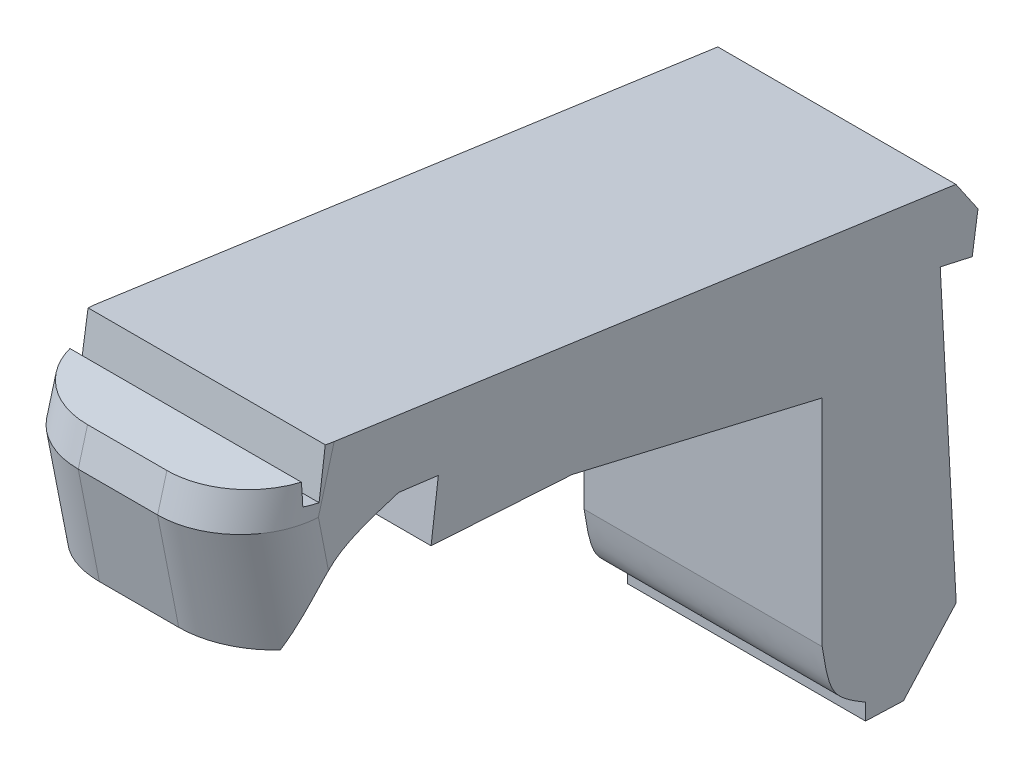
from build123d import *

# Parameters (mm, degrees)
BOSS_EXTRUDE1_DEPTH = 457.2
FILLET1_R           = 152.4


with BuildPart() as part:
    # Sketch1 → Boss-Extrude1 (new body)
    with BuildSketch(Plane(origin=(0, 0, 0), x_dir=(0, 0, -1), z_dir=(1, 0, 0))):
        with BuildLine():
            Line((711.548200753, -160.15002575), (669.063267675, -98.166541557))
            Line((669.063267675, -98.166541557), (-541.133997798, 73.322803393))
            Line((-541.133997798, 73.322803393), (-553.825031188, -16.23759413))
            Line((-553.825031188, -16.23759413), (-581.492567074, -11.395775351))
            Line((-581.492567074, -11.395775351), (-581.492567074, 28.611066701))
            Line((-581.492567074, 28.611066701), (-693.769833475, 31.192153284))
            Line((-693.769833475, 31.192153284), (-711.548200753, -33.910775567))
            Line((-711.548200753, -33.910775567), (-671.038221505, -241.199727441))
            Line((-671.038221505, -241.199727441), (-601.675855782, -250.529122735))
            add(Edge.make_bspline(
                [(-601.675855782, -250.529122735), (-541.133997798, -117.43304901), (-401.043539171, -75.545762029)],
                knots=[0, 0, 0, 1, 1, 1], degree=2, weights=[1, 2.246019703, 1]))
            Line((-401.043539171, -75.545762029), (-324.808759835, -85.222901727))
            Line((-324.808759835, -85.222901727), (-338.797926094, -195.427056695))
            Line((-338.797926094, -195.427056695), (-67.759534981, -212.336640741))
            Line((-67.759534981, -212.336640741), (412.240396354, -324.981912238))
            Line((412.240396354, -324.981912238), (412.240396354, -738.576379205))
            add(Edge.make_bspline(
                [(412.240396354, -738.576379205), (426.282298959, -832.127735112), (495.591928337, -872.720699723)],
                knots=[0, 0, 0, 1, 1, 1], degree=2, weights=[1, 2.18722751, 1]))
            Line((495.591928337, -872.720699723), (495.591928337, -904.174333001))
            Line((495.591928337, -904.174333001), (568.451677177, -906.798188592))
            Line((568.451677177, -906.798188592), (669.726727221, -794.275861448))
            Line((669.726727221, -794.275861448), (638.979909752, -220.499963189))
            Line((638.979909752, -220.499963189), (700.473544691, -234.202580835))
            Line((700.473544691, -234.202580835), (711.548200753, -160.15002575))
        make_face()
    extrude(amount=BOSS_EXTRUDE1_DEPTH)

    # Fillet1
    fillet1_edges = [part.edges().sort_by_distance(p)[0] for p in [
        (0, -137.555251504, 691.293211129),
        (0, -1.359311141, 702.659017114),
        (457.2, -137.555251504, 691.293211129),
        (457.2, -1.359311141, 702.659017114),
    ]]
    fillet(fillet1_edges, radius=FILLET1_R)


solid = part.part
